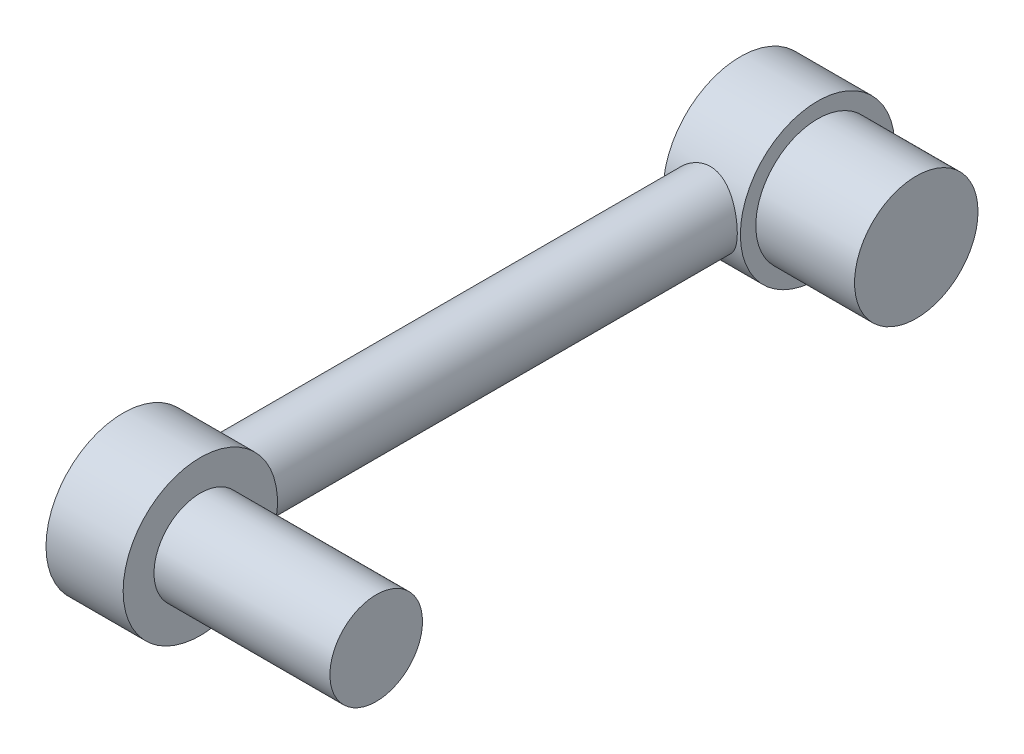
from build123d import *

# Parameters (mm, degrees)
SKETCH1_R           = 29.21
BOSS_EXTRUDE1_DEPTH = 406.4
SKETCH2_W           = 63.5
SKETCH2_H           = 63.5
SKETCH3_R           = 50.8
BOSS_EXTRUDE2_DEPTH = 81.28
SKETCH10_W          = 63.5
SKETCH10_H          = 63.5
SKETCH5_R           = 50.8
CUT_EXTRUDE1_DEPTH  = 40.64
SKETCH11_R          = 38.1
BOSS_EXTRUDE4_DEPTH = 144.78
SKETCH16_R          = 38.1
CUT_EXTRUDE2_DEPTH  = 12.7
SCALE1_SCALE        = 0.03937


with BuildPart() as part:
    # Sketch1 → Boss-Extrude1 (new body)
    with BuildSketch(Plane.XY):
        Circle(SKETCH1_R)
    extrude(amount=BOSS_EXTRUDE1_DEPTH)

    # Sketch2 → Revolve1 (revolve)
    with BuildSketch(Plane(origin=(0, 0, 0), x_dir=(1, 0, 0), z_dir=(0, 1, 0))):
        with Locations((0, 19.05)):
            Rectangle(SKETCH2_W, SKETCH2_H)
    revolve(axis=Axis((-31.75, 0, -50.8), (1, 0, 0)))

    # Sketch3 → Boss-Extrude2 (add)
    with BuildSketch(Plane(origin=(31.75, 0, 0), x_dir=(0, 0, -1), z_dir=(1, 0, 0))):
        with Locations((50.8, 0)):
            Circle(SKETCH3_R)
    extrude(amount=BOSS_EXTRUDE2_DEPTH)

    # Sketch10 → Revolve2 (revolve)
    with BuildSketch(Plane(origin=(0, 0, 0), x_dir=(1, 0, 0), z_dir=(0, 1, 0)), mode=Mode.PRIVATE) as revolve2_sk:
        with Locations((0, -425.45)):
            Rectangle(SKETCH10_W, SKETCH10_H)
    revolve(revolve2_sk.sketch.rotate(Axis((-31.75, 0, 457.2), (1, 0, 0)), 180), axis=Axis((-31.75, 0, 457.2), (1, 0, 0)))

    # Sketch5 → Cut-Extrude1 (cut)
    with BuildSketch(Plane.ZY.offset(31.75)):
        with Locations(Location((-50.8, 0, 0), (0, 0, 180))):
            Circle(SKETCH5_R)
    extrude(amount=-CUT_EXTRUDE1_DEPTH, mode=Mode.SUBTRACT)

    # Sketch11 → Boss-Extrude4 (add)
    with BuildSketch(Plane(origin=(31.75, 0, 0), x_dir=(0, 0, -1), z_dir=(1, 0, 0))):
        with Locations((-457.2, 0)):
            Circle(SKETCH11_R)
    extrude(amount=BOSS_EXTRUDE4_DEPTH)

    # Sketch16 → Cut-Extrude2 (cut)
    with BuildSketch(Plane.ZY.offset(31.75)):
        with Locations(Location((457.2, 0, 0), (0, 0, 180))):
            Circle(SKETCH16_R)
    extrude(amount=-CUT_EXTRUDE2_DEPTH, mode=Mode.SUBTRACT)


with BuildPart() as part_1:
    # Scale1: scaled about (34.078233281, 5.4627e-05, 222.606303222)
    add(part.part.scale(SCALE1_SCALE).moved(Location((32.736573237, 5.2476e-05, 213.842293064))))


solid = part_1.part
